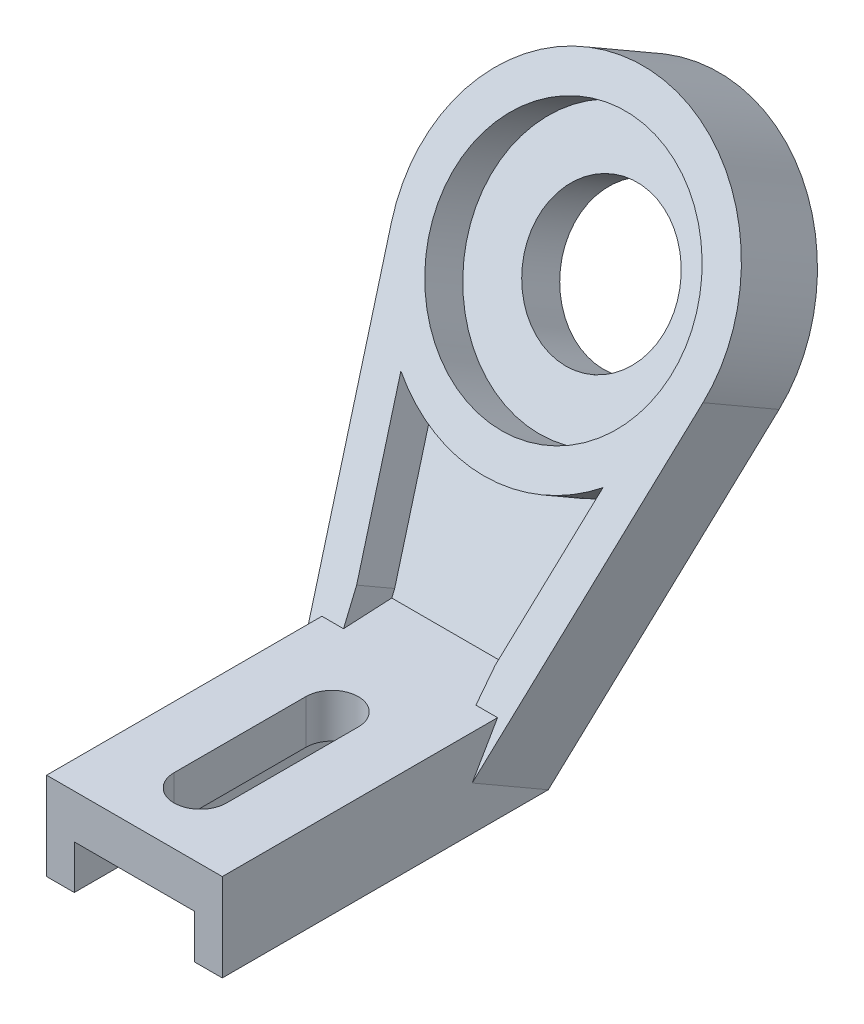
from build123d import *
from build123d.topology import SkipClean

# Parameters (mm, degrees)
SKETCH1_W               = 12.7
SKETCH1_H               = 25.4
BOSS_EXTRUDE1_DEPTH     = 3.175
SKETCH17_W              = 12.7
SKETCH17_H              = 3.175
BOSS_EXTRUDE5_DEPTH     = 31.75
F_3_8_CLEARANCE_HOLE1_D = 10.31748
BOSS_EXTRUDE6_DEPTH     = 3.175
CUT_EXTRUDE4_DEPTH      = 52.789749346
SKETCH31_W              = 2.00025
SKETCH31_H              = 25.4
BOSS_EXTRUDE9_DEPTH     = 18.034
CUT_EXTRUDE6_DEPTH      = 54.550805677
CUT_EXTRUDE6_DEPTH_BACK = 54.550805677
BOSS_EXTRUDE10_START    = -3.175
BOSS_EXTRUDE10_DEPTH    = 3.175
BOSS_EXTRUDE11_START    = 3.175
BOSS_EXTRUDE11_DEPTH    = 3.175


with BuildPart() as part:
    # Sketch1 → Boss-Extrude1 (new body)
    with BuildSketch(Plane(origin=(0, 0, 0), x_dir=(1, 0, 0), z_dir=(0, 1, 0))):
        with Locations((0, 12.7)):
            Rectangle(SKETCH1_W, SKETCH1_H)
    extrude(amount=BOSS_EXTRUDE1_DEPTH)

    # Sketch17 → Boss-Extrude5 (add)
    with BuildSketch(Plane(origin=(0, 10.998522628, -6.35), x_dir=(-1, 0, 0), z_dir=(0, 0.866025403784438, -0.500000000000001))):
        with Locations((0, -20.409545256)):
            Rectangle(SKETCH17_W, SKETCH17_H)
    extrude(amount=BOSS_EXTRUDE5_DEPTH)

    # 3/8 Clearance Hole1 (through all)
    with Locations(Plane(origin=(0, -9.411022628, -16.300369343), x_dir=(1, 0, 0), z_dir=(0, 0.5000000000000011, 0.8660254037844379))):
        with Locations((0, 34.925)):
            Hole(F_3_8_CLEARANCE_HOLE1_D / 2)

    # Sketch26 → Boss-Extrude6 (add)
    with BuildSketch(Plane(origin=(0, -9.411022628, -16.300369343), x_dir=(1, 0, 0), z_dir=(0, 0.5000000000000011, 0.8660254037844379))):
        with BuildLine():
            ThreePointArc((6.35, 25.326635744), (10.137346679, 29.47657833), (11.50874, 34.925))
            ThreePointArc((11.50874, 34.925), (-5.44842167, 45.062346679), (-6.35, 25.326635744))
            Line((-6.35, 25.326635744), (-6.35, 44.45))
            Line((-6.35, 44.45), (6.35, 44.45))
            Line((6.35, 44.45), (6.35, 25.326635744))
        make_face()
    extrude(amount=-BOSS_EXTRUDE6_DEPTH)

    # Sketch27 → Cut-Extrude4 (cut, through all)
    with BuildSketch(Plane(origin=(0, 3.175, 0), x_dir=(1, 0, 0), z_dir=(0, 1, 0))):
        with BuildLine():
            Line((1.89865, 14.2875), (1.89865, 4.7625))
            ThreePointArc((1.89865, 4.7625), (0, 2.86385), (-1.89865, 4.7625))
            Line((-1.89865, 4.7625), (-1.89865, 14.2875))
            ThreePointArc((-1.89865, 14.2875), (0, 16.18615), (1.89865, 14.2875))
        make_face()
    extrude(amount=-CUT_EXTRUDE4_DEPTH, mode=Mode.SUBTRACT)

    # Sketch31 → Boss-Extrude9 (add)
    with BuildSketch(Plane.XZ):
        with Locations((-5.349875, -12.7)):
            Rectangle(SKETCH31_W, SKETCH31_H)
        with Locations((5.349875, -12.7)):
            Rectangle(SKETCH31_W, SKETCH31_H)
    extrude(amount=BOSS_EXTRUDE9_DEPTH)

    # Sketch32 → Cut-Extrude6 (cut, two sides: drawn at the far end of the back side and taken through both)
    with BuildSketch(Plane(origin=(0, 0, 0), x_dir=(0, 0, -1), z_dir=(1, 0, 0)).offset(-CUT_EXTRUDE6_DEPTH_BACK)):
        Polygon((0, -3.175), (23.566912895, -3.175), (25.4, 0), (41.090286181, -22.96252164), (-8.953256295, -22.624237032), align=None)
    extrude(amount=CUT_EXTRUDE6_DEPTH + CUT_EXTRUDE6_DEPTH_BACK, mode=Mode.SUBTRACT)

    # Sketch35 → Boss-Extrude10 (add)
    with BuildSketch(Plane(origin=(0, -10.998522628, -19.05), x_dir=(-1, 0, 0), z_dir=(0, -0.5000000000000012, -0.866025403784438)).offset(BOSS_EXTRUDE10_START)):
        with BuildLine():
            Line((-6.35, 9.033825791), (-11.26569769, 32.572309637))
            ThreePointArc((-11.26569769, 32.572309637), (-9.523820075, 28.463734832), (-6.35, 25.326635744))
            Line((-6.35, 25.326635744), (-6.35, 9.033825791))
        make_face()
        with BuildLine():
            Line((6.35, 9.033825791), (11.26569769, 32.572309637))
            ThreePointArc((11.26569769, 32.572309637), (9.523820075, 28.463734832), (6.35, 25.326635744))
            Line((6.35, 25.326635744), (6.35, 9.033825791))
        make_face()
    extrude(amount=BOSS_EXTRUDE10_DEPTH)

    # Sketch36 → Boss-Extrude11 (add)
    with SkipClean():  # the faces are left unmerged after this step: merging them gives an invalid solid
        with BuildSketch(Plane(origin=(0, -9.411022628, -16.300369343), x_dir=(1, 0, 0), z_dir=(0, 0.500000000000001, 0.8660254037844382)).offset(BOSS_EXTRUDE11_START)):
            with BuildLine():
                Line((-5.010829857, 15.04630998), (-4.471472861, 9.426131072))
                Line((-4.471472861, 9.426131072), (-6.35, 9.033825791))
                Line((-6.35, 9.033825791), (-11.26569769, 32.572309637))
                ThreePointArc((-11.26569769, 32.572309637), (0, 46.43374), (11.26569769, 32.572309637))
                Line((11.26569769, 32.572309637), (6.35, 9.033825791))
                Line((6.35, 9.033825791), (4.471472861, 9.426131072))
                Line((4.471472861, 9.426131072), (5.010829857, 15.04630998))
                Line((5.010829857, 15.04630998), (7.30501638, 26.031866015))
                ThreePointArc((7.30501638, 26.031866015), (0, 23.41626), (-7.30501638, 26.031866015))
                Line((-7.30501638, 26.031866015), (-5.010829857, 15.04630998))
            make_face()
            with BuildLine():
                ThreePointArc((-8.779337573, 33.09155271), (0, 25.95626), (8.779337573, 33.09155271))
                ThreePointArc((8.779337573, 33.09155271), (0, 43.89374), (-8.779337573, 33.09155271))
            make_face(mode=Mode.SUBTRACT)
        extrude(amount=-BOSS_EXTRUDE11_DEPTH)


solid = part.part
